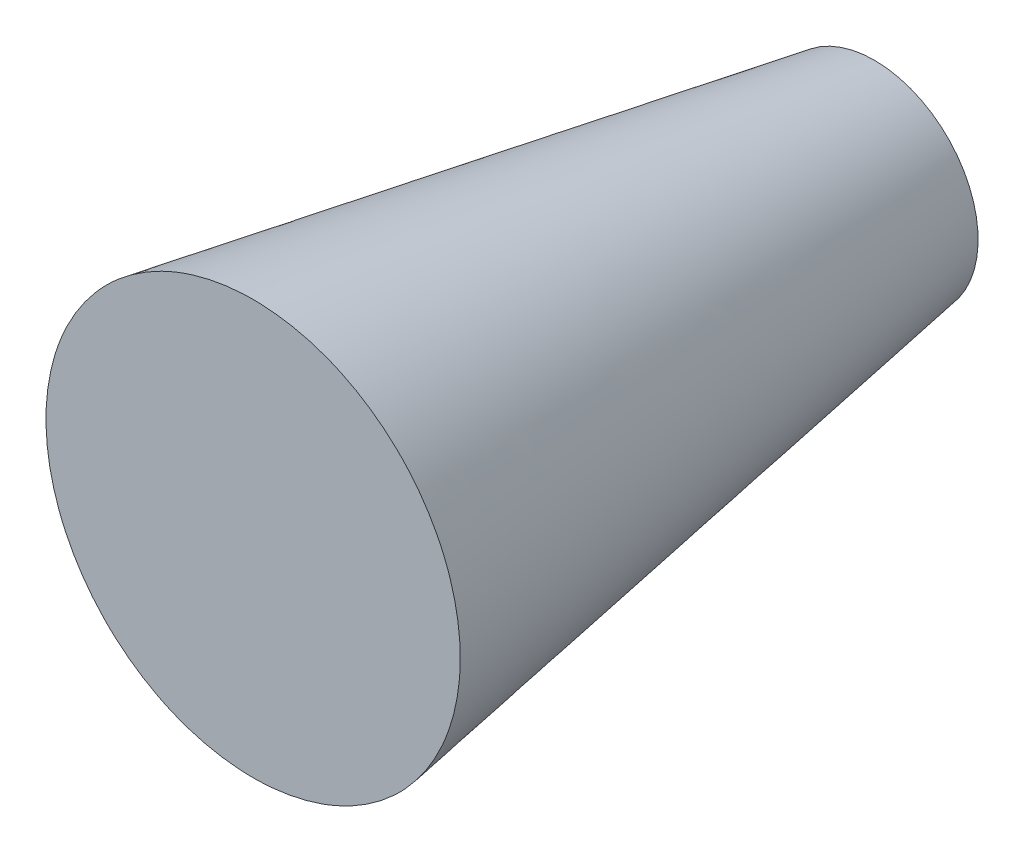
from build123d import *

# Parameters (mm, degrees)
PROFILE1_R = 5
PROFILE2_R = 7.5
PROFILE3_R = 10


with BuildPart() as part:
    # Profile1 → modern_loft_pick_points3 section 0
    with BuildSketch(Plane.XY):
        Circle(PROFILE1_R)
    # Profile2 → modern_loft_pick_points3 section 1
    with BuildSketch(Plane.XY.offset(15)):
        Circle(PROFILE2_R)
    # Profile3 → modern_loft_pick_points3 section 2
    with BuildSketch(Plane.XY.offset(30)):
        Circle(PROFILE3_R)
    loft()


solid = part.part
